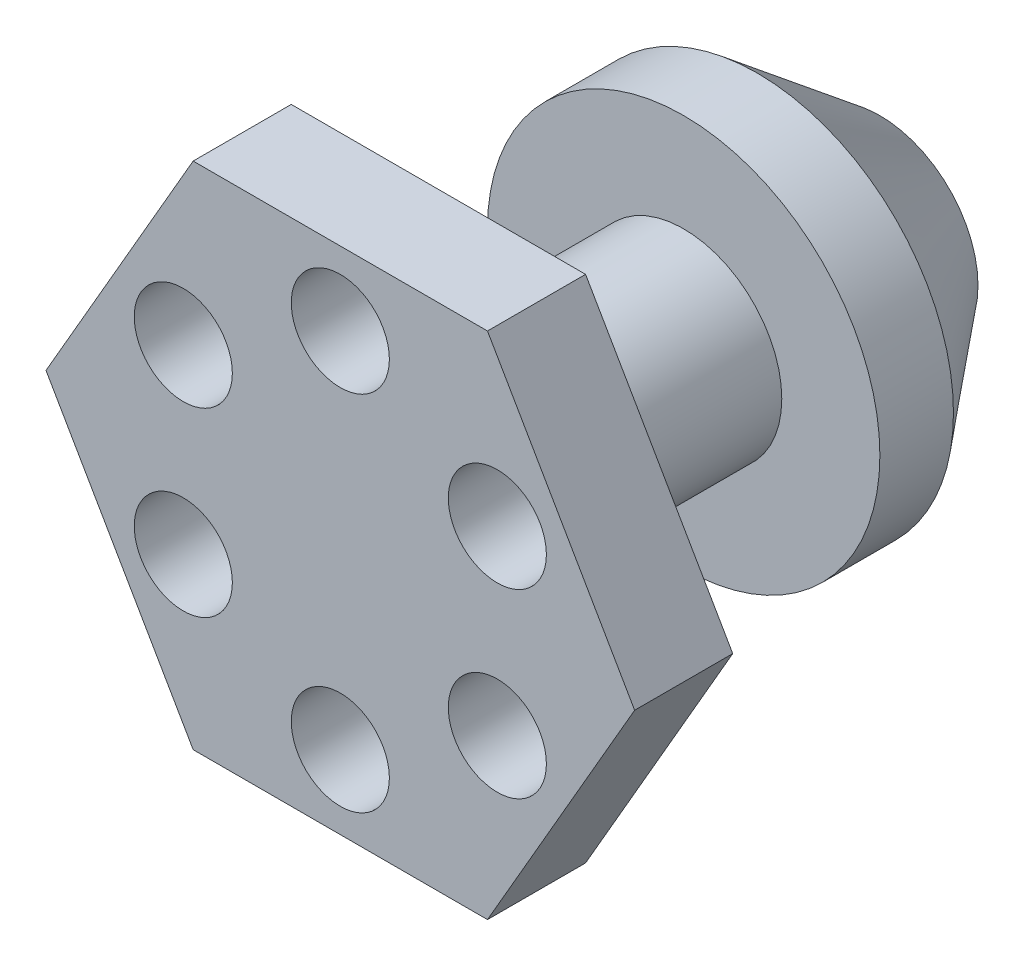
from build123d import *

# Parameters (mm, degrees)
SKETCH1_R           = 12.7
BOSS_EXTRUDE3_DEPTH = 25.4


with BuildPart() as part:
    # Sketch1 → Boss-Extrude3 (new body)
    with BuildSketch(Plane.XY):
        Polygon((-76.2, 0), (-38.1, -65.991135768), (38.1, -65.991135768), (76.2, 0), (38.1, 65.991135768), (-38.1, 65.991135768), align=None)
        with Locations((0, -46.941135768)):
            Circle(SKETCH1_R, mode=Mode.SUBTRACT)
        with Locations((-40.652216058, -23.470567884)):
            Circle(SKETCH1_R, mode=Mode.SUBTRACT)
        with Locations((-40.652216058, 23.470567884)):
            Circle(SKETCH1_R, mode=Mode.SUBTRACT)
        with Locations((0, 46.941135768)):
            Circle(SKETCH1_R, mode=Mode.SUBTRACT)
        with Locations((40.652216058, 23.470567884)):
            Circle(SKETCH1_R, mode=Mode.SUBTRACT)
        with Locations((40.652216058, -23.470567884)):
            Circle(SKETCH1_R, mode=Mode.SUBTRACT)
    extrude(amount=BOSS_EXTRUDE3_DEPTH)

    # Sketch2 → Revolve-Thin1 (revolve)
    with BuildSketch(Plane(origin=(0, 0, 0), x_dir=(1, 0, 0), z_dir=(0, 1, 0))):
        Polygon((0, 0), (0, 114.3), (25.4, 114.3), (50.8, 82.55), (50.8, 63.5), (25.4, 63.5), (25.4, 0), (22.86, 0), (22.86, 66.04), (48.26, 66.04), (48.26, 81.659016109), (24.179212887, 111.76), (2.54, 111.76), (2.54, 0), align=None)
    revolve(axis=Axis((0, 0, -33.186581784), (0, 0, -1)))


solid = part.part
